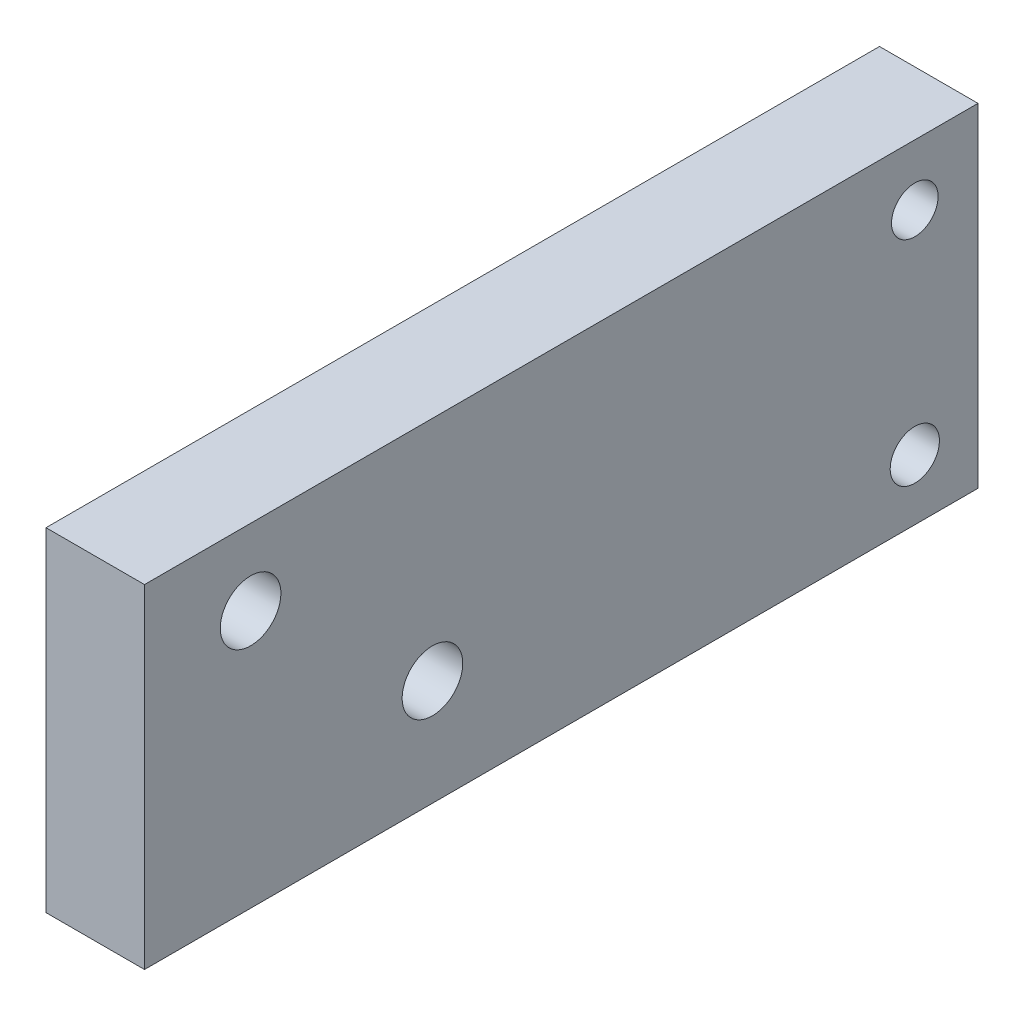
from build123d import *

# Parameters (mm, degrees)
BOSS_EXTRU_1_DEPTH      = 20
ESQUISSE3_W             = 4
ESQUISSE3_H             = 18
BOSS_EXTRU_2_DEPTH      = 20
ESQUISSE4_W             = 4
ESQUISSE4_H             = 18
BOSS_EXTRU_3_DEPTH      = 20
ESQUISSE5_W             = 17.65
ESQUISSE5_H             = 18
ESQUISSE5_W_2           = 16.35
ESQUISSE5_R             = 2
ENL_V_MAT_EXTRU_1_DEPTH = 20
ESQUISSE6_W             = 4
ESQUISSE6_H             = 26
BOSS_EXTRU_4_DEPTH      = 4
ESQUISSE7_R             = 2
ENL_V_MAT_EXTRU_2_DEPTH = 4
ESQUISSE8_R             = 2
ENL_V_MAT_EXTRU_3_DEPTH = 4
ESQUISSE9_W             = 4
ESQUISSE9_H             = 26
BOSS_EXTRU_5_DEPTH      = 8
ENL_V_MAT_EXTRU_5_DEPTH = 8
ESQUISSE13_W            = 20.25
ESQUISSE13_H            = 28
ENL_V_MAT_EXTRU_7_DEPTH = 46.255524525
ESQUISSE14_W            = 29
ESQUISSE14_H            = 22
ESQUISSE14_R            = 1.537122226
ESQUISSE14_R_2          = 1.624788677
BOSS_EXTRU_6_DEPTH      = 6.5
BOSS_EXTRU_7_START      = 2.5
ESQUISSE15_W            = 26
ESQUISSE15_H            = 22
ESQUISSE15_R            = 2
BOSS_EXTRU_7_DEPTH      = 2.5


with BuildPart() as part:
    # Esquisse1 → Boss.-Extru.1 (new body)
    with BuildSketch(Plane.XY):
        Polygon((0, 16), (0, 0), (24.25, 0), (24.25, 2), (4, 2), (4, 16), align=None)
        Polygon((24.25, 0), (0, 0), (0, -2), (20.25, -2), (20.25, -24), (24.25, -24), align=None)
    extrude(amount=BOSS_EXTRU_1_DEPTH)

    # Esquisse3 → Boss.-Extru.2 (add)
    with BuildSketch(Plane(origin=(0, 0, 0), x_dir=(-1, 0, 0), z_dir=(0, 0, -1))):
        with Locations((-2, 7)):
            Rectangle(ESQUISSE3_W, ESQUISSE3_H)
    extrude(amount=BOSS_EXTRU_2_DEPTH)

    # Esquisse4 → Boss.-Extru.3 (add)
    with BuildSketch(Plane.XY.offset(20)):
        with Locations((2, 7)):
            Rectangle(ESQUISSE4_W, ESQUISSE4_H)
    extrude(amount=BOSS_EXTRU_3_DEPTH)

    # Esquisse5 → Enlèv. mat.-Extru.1 (cut)
    with BuildSketch(Plane.ZY):
        with Locations((-11.175, 7)):
            Rectangle(ESQUISSE5_W, ESQUISSE5_H)
        with Locations((31.825, 7)):
            Rectangle(ESQUISSE5_W_2, ESQUISSE5_H)
        with Locations((16.65, 15)):
            Circle(ESQUISSE5_R)
        with Locations((4.65, 5)):
            Circle(ESQUISSE5_R)
    extrude(amount=-ENL_V_MAT_EXTRU_1_DEPTH, mode=Mode.SUBTRACT)

    # Esquisse6 → Boss.-Extru.4 (add)
    with BuildSketch(Plane(origin=(0, 16, 0), x_dir=(1, 0, 0), z_dir=(0, 1, 0))):
        with Locations((2, -10.65)):
            Rectangle(ESQUISSE6_W, ESQUISSE6_H)
    extrude(amount=BOSS_EXTRU_4_DEPTH)

    # Esquisse7 → Enlèv. mat.-Extru.2 (cut)
    with BuildSketch(Plane.ZY):
        with Locations((16.65, 15)):
            Circle(ESQUISSE7_R)
    extrude(amount=-ENL_V_MAT_EXTRU_2_DEPTH, mode=Mode.SUBTRACT)

    # Esquisse8 → Enlèv. mat.-Extru.3 (cut)
    with BuildSketch(Plane.ZY.offset(-20.25)):
        with Locations((20, -7)):
            Circle(ESQUISSE8_R)
        with Locations((20, -20)):
            Circle(ESQUISSE8_R)
    extrude(amount=-ENL_V_MAT_EXTRU_3_DEPTH, mode=Mode.SUBTRACT)

    # Esquisse9 → Boss.-Extru.5 (add)
    with BuildSketch(Plane.XY.offset(20)):
        with Locations((22.25, -11)):
            Rectangle(ESQUISSE9_W, ESQUISSE9_H)
    extrude(amount=BOSS_EXTRU_5_DEPTH)

    # Esquisse11 → Enlèv. mat.-Extru.5 (cut)
    with BuildSketch(Plane.ZY.offset(-20.25)):
        with BuildLine():
            ThreePointArc((20, -9), (21.414213562, -8.414213562), (22, -7))
            ThreePointArc((22, -7), (21.414213562, -5.585786438), (20, -5))
            Line((20, -5), (20, -9))
        make_face()
        with BuildLine():
            Line((20, -9), (20, -5))
            ThreePointArc((20, -5), (18, -7), (20, -9))
        make_face()
        with BuildLine():
            ThreePointArc((20, -22), (21.414213562, -21.414213562), (22, -20))
            ThreePointArc((22, -20), (21.414213562, -18.585786438), (20, -18))
            Line((20, -18), (20, -22))
        make_face()
        with BuildLine():
            Line((20, -22), (20, -18))
            ThreePointArc((20, -18), (18, -20), (20, -22))
        make_face()
        Polygon((14, -24), (0, -2), (0, -24), align=None)
    extrude(amount=-ENL_V_MAT_EXTRU_5_DEPTH, mode=Mode.SUBTRACT)

    # Esquisse13 → Enlèv. mat.-Extru.7 (cut, through all)
    with BuildSketch(Plane(origin=(0, 2, 0), x_dir=(1, 0, 0), z_dir=(0, 1, 0))):
        with Locations((14.125, -14)):
            Rectangle(ESQUISSE13_W, ESQUISSE13_H)
    extrude(amount=-ENL_V_MAT_EXTRU_7_DEPTH, mode=Mode.SUBTRACT)

    # Esquisse14 → Boss.-Extru.6 (add)
    with BuildSketch(Plane(origin=(4, 0, 0), x_dir=(0, 0, -1), z_dir=(1, 0, 0))):
        with Locations((16.85, 9)):
            Rectangle(ESQUISSE14_W, ESQUISSE14_H)
        with Locations(Location((27.18, 16, 0), (0, 0, 90))):
            Circle(ESQUISSE14_R, mode=Mode.SUBTRACT)
        with Locations(Location((27.18, 2, 0), (0, 0, 90))):
            Circle(ESQUISSE14_R_2, mode=Mode.SUBTRACT)
    extrude(amount=-BOSS_EXTRU_6_DEPTH)

    # Esquisse15 → Boss.-Extru.7 (add)
    with BuildSketch(Plane.ZY.offset(BOSS_EXTRU_7_START)):
        with Locations((10.65, 9)):
            Rectangle(ESQUISSE15_W, ESQUISSE15_H)
        with Locations((4.65, 5)):
            Circle(ESQUISSE15_R, mode=Mode.SUBTRACT)
        with Locations((16.65, 15)):
            Circle(ESQUISSE15_R, mode=Mode.SUBTRACT)
    extrude(amount=-BOSS_EXTRU_7_DEPTH)


solid = part.part
